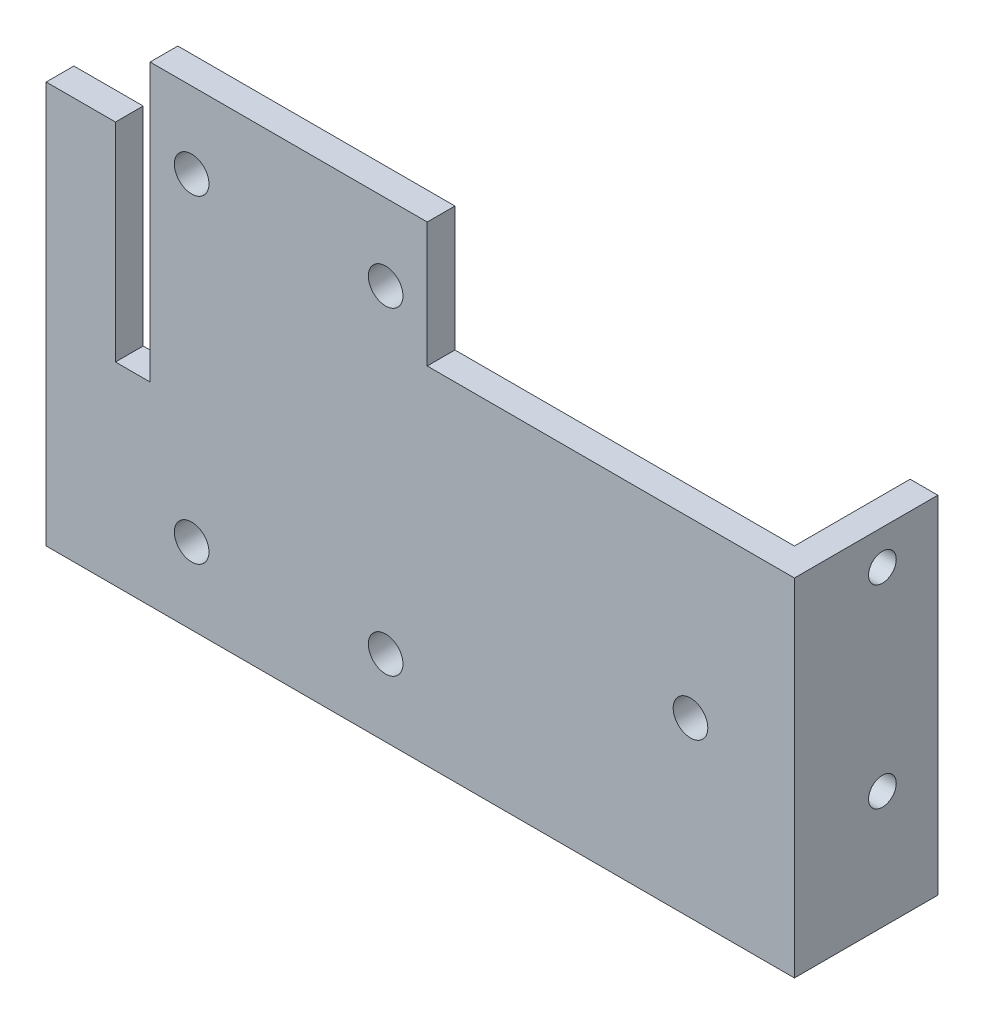
from build123d import *

# Parameters (mm, degrees)
SKETCH_1_R          = 2.5
EXTRUDE_1_DEPTH     = 4
SKETCH_2_W          = 4
SKETCH_2_H          = 50
EXTRUDE_2_DEPTH     = 20.7
SKETCH_3_R          = 2
CUT_EXTRUDE_1_DEPTH = 6.7
CUT_EXTRUDE_2_DEPTH = 10


with BuildPart() as part:
    # Эскиз1 → Бобышка-Вытянуть1 (new body)
    with BuildSketch(Plane.XY):
        Polygon((0, 0), (108, 0), (108, 50), (55, 50), (55, 68), (0, 68), align=None)
        with Locations((21, 57)):
            Circle(SKETCH_1_R, mode=Mode.SUBTRACT)
        with Locations((49, 57)):
            Circle(SKETCH_1_R, mode=Mode.SUBTRACT)
        with Locations((21, 11)):
            Circle(SKETCH_1_R, mode=Mode.SUBTRACT)
        with Locations((49, 11)):
            Circle(SKETCH_1_R, mode=Mode.SUBTRACT)
        with Locations((93, 25)):
            Circle(SKETCH_1_R, mode=Mode.SUBTRACT)
    extrude(amount=EXTRUDE_1_DEPTH)

    # Эскиз2 → Бобышка-Вытянуть2 (add)
    with BuildSketch(Plane.XY.offset(4)):
        with Locations((106, 25)):
            Rectangle(SKETCH_2_W, SKETCH_2_H)
    extrude(amount=-EXTRUDE_2_DEPTH)

    # Эскиз3 → Вырез-Вытянуть1 (cut)
    with BuildSketch(Plane(origin=(108, 0, 0), x_dir=(0, 0, -1), z_dir=(1, 0, 0))):
        with Locations((8.7, 45)):
            Circle(SKETCH_3_R)
        with Locations((8.7, 17)):
            Circle(SKETCH_3_R)
    extrude(amount=-CUT_EXTRUDE_1_DEPTH, mode=Mode.SUBTRACT)

    # Эскиз4 → Вырез-Вытянуть2 (cut)
    with BuildSketch(Plane(origin=(0, 0, 0), x_dir=(-1, 0, 0), z_dir=(0, 0, -1))):
        Polygon((0, 68), (-15, 68), (-15, 48), (-15, 28), (-10, 28), (-10, 58), (0, 58), align=None)
    extrude(amount=-CUT_EXTRUDE_2_DEPTH, mode=Mode.SUBTRACT)


solid = part.part
